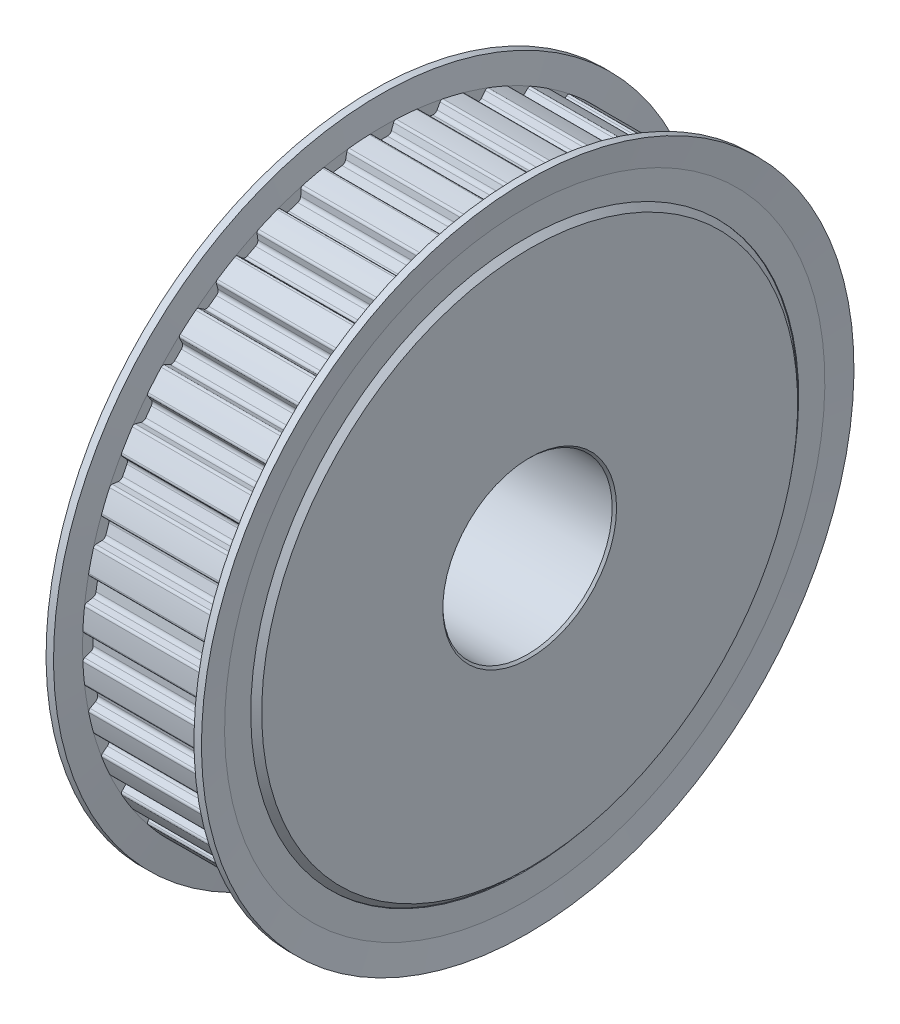
from build123d import *

# Parameters (mm, degrees)
CUT_EXTRUDE_START        = 29.5
CUT_EXTRUDE_1_DEPTH      = 27
PATTERN_CIRCULAR_1_COUNT = 40
SKETCH_6_R               = 17
CUT_EXTRUDE_2_DEPTH      = 99.002550987
CHAMFER_1_SIZE           = 0.44
SCALE_1_SCALE            = 0.35294


with BuildPart() as part:
    # 草图3 → 旋转1 (revolve)
    with BuildSketch(Plane.XY):
        Polygon((0, 0), (0, 53.8), (1.2, 55), (2.5, 55), (2.5, 60.255), (29.5, 60.255), (29.5, 55), (30.8, 55), (32, 53.8), (32, 0), align=None)
    revolve(axis=Axis((32, 0, 0), (-1, 0, 0)))

    # 草图4 → 切除-拉伸1 (cut)
    with BuildSketch(Plane(origin=(0, 0, 0), x_dir=(0, 0, -1), z_dir=(1, 0, 0)).offset(CUT_EXTRUDE_START)):
        with BuildLine():
            Line((-0.947821517, 58.125), (0.947821517, 58.125))
            ThreePointArc((0.947821517, 58.125), (1.441097252, 58.280529242), (1.755957171, 58.690862677))
            Line((1.755957171, 58.690862677), (2.176522197, 59.846355589))
            ThreePointArc((2.176522197, 59.846355589), (2.380363364, 60.105934954), (2.698293341, 60.194553226))
            ThreePointArc((2.698293341, 60.194553226), (0, 60.255), (-2.698293341, 60.194553226))
            ThreePointArc((-2.698293341, 60.194553226), (-2.380363364, 60.105934954), (-2.176522197, 59.846355589))
            Line((-2.176522197, 59.846355589), (-1.755957171, 58.690862677))
            ThreePointArc((-1.755957171, 58.690862677), (-1.441097252, 58.280529242), (-0.947821517, 58.125))
        make_face()
    cut_extrude_1 = extrude(amount=-CUT_EXTRUDE_1_DEPTH, mode=Mode.SUBTRACT)

    # 阵列(圆周)1: 切除-拉伸1 ×40 about axis
    pattern_circular_1_axis = Axis((0, 0, 0), (1, 0, 0))
    for i in range(1, PATTERN_CIRCULAR_1_COUNT):
        add(cut_extrude_1.rotate(pattern_circular_1_axis, i * 360 / PATTERN_CIRCULAR_1_COUNT), mode=Mode.SUBTRACT)

    # 草图5 → 旋转2 (revolve)
    with BuildSketch(Plane.XY, mode=Mode.PRIVATE) as revolve_2_sk:
        Polygon((1.9, 65.5), (2.5, 60.255), (2.5, 55), (1, 55), (1, 60.255), (0.4, 65.5), align=None)
        Polygon((31, 55), (29.5, 55), (29.5, 60.255), (30.1, 65.5), (31.6, 65.5), (31, 60.255), align=None)
    revolve(revolve_2_sk.sketch.rotate(Axis((0, 0, 0), (1, 0, 0)), 180), axis=Axis((0, 0, 0), (1, 0, 0)))

    # 草图6 → 切除-拉伸2 (cut, through all)
    with BuildSketch(Plane(origin=(0, 0, 0), x_dir=(0, 0, -1), z_dir=(1, 0, 0))):
        Circle(SKETCH_6_R)
    extrude(amount=CUT_EXTRUDE_2_DEPTH, mode=Mode.SUBTRACT)

    # 倒角1
    chamfer_1_edges = [part.edges().sort_by_distance(p)[0] for p in [
        (0, 0, 17),
        (32, 0, 17),
    ]]
    chamfer(chamfer_1_edges, length=CHAMFER_1_SIZE)


with BuildPart() as part_1:
    # 缩放比例1: scaled about (0, 0, 0)
    add(part.part.scale(SCALE_1_SCALE))


solid = part_1.part
